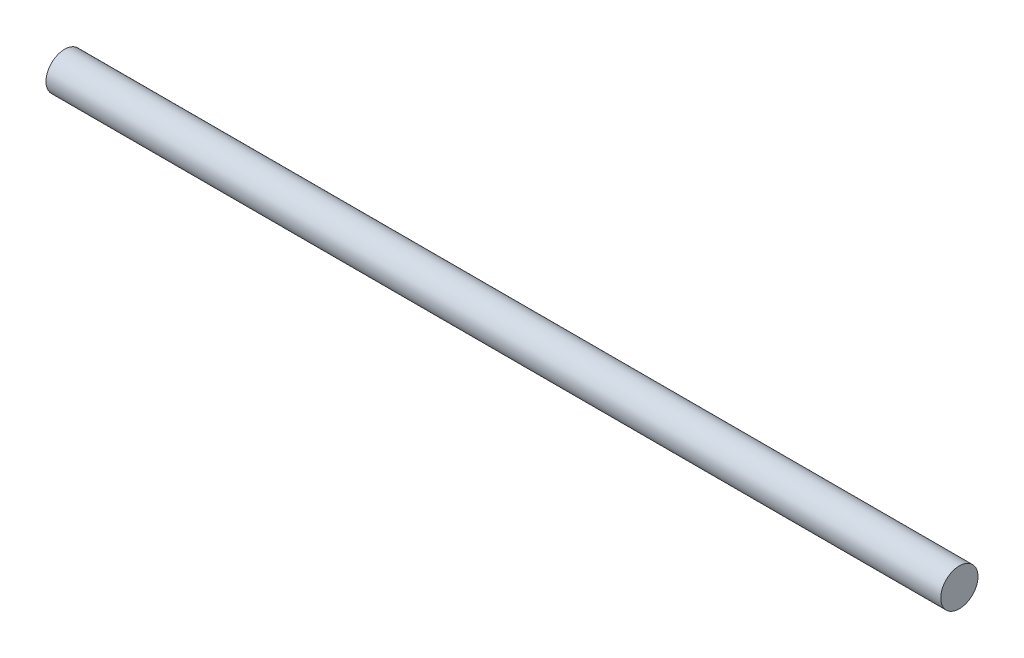
from build123d import *

# Parameters (mm, degrees)
SKETCH1_R           = 2.5
BOSS_EXTRUDE1_DEPTH = 120


with BuildPart() as part:
    # Sketch1 → Boss-Extrude1 (new body)
    with BuildSketch(Plane(origin=(0, 0, 0), x_dir=(0, 0, -1), z_dir=(1, 0, 0))):
        Circle(SKETCH1_R)
    extrude(amount=BOSS_EXTRUDE1_DEPTH)


solid = part.part
